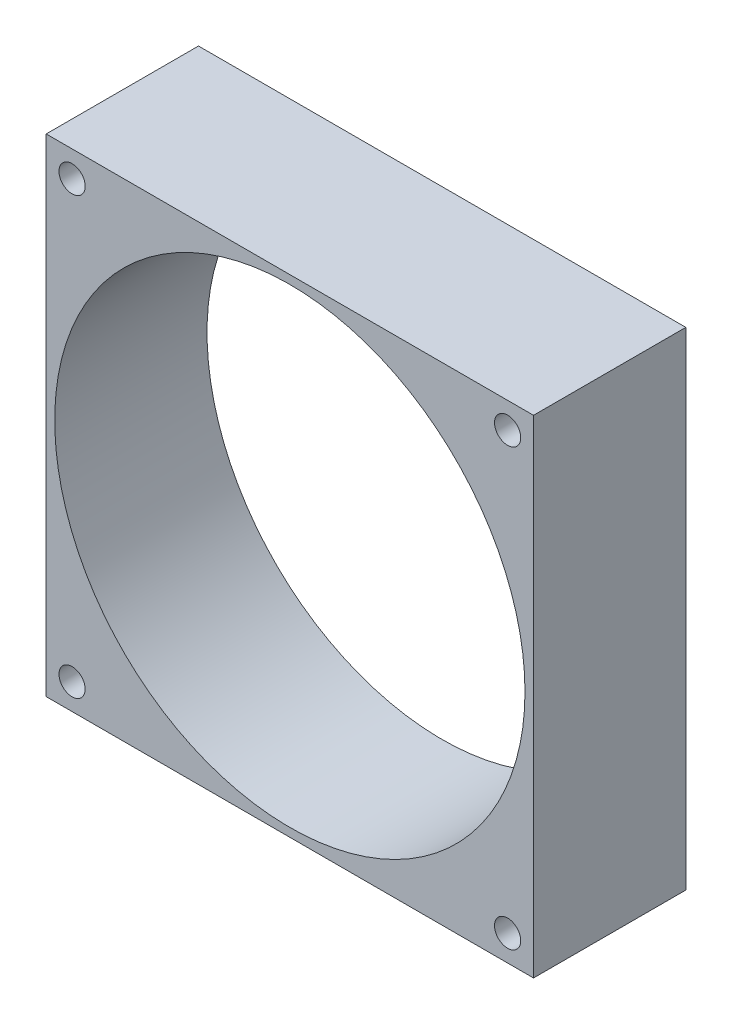
from build123d import *

# Parameters (mm, degrees)
SKETCH1_W           = 80
SKETCH1_H           = 80
SKETCH1_R           = 38.6
SKETCH1_R_2         = 2.15
BOSS_EXTRUDE1_DEPTH = 25


with BuildPart() as part:
    # Sketch1 → Boss-Extrude1 (new body)
    with BuildSketch(Plane.XY):
        with Locations((40, 40)):
            Rectangle(SKETCH1_W, SKETCH1_H)
        with Locations((40, 40)):
            Circle(SKETCH1_R, mode=Mode.SUBTRACT)
        with Locations((4.25, 75.75)):
            Circle(SKETCH1_R_2, mode=Mode.SUBTRACT)
        with Locations(Location((75.75, 75.75, 0), (0, 0, 180))):
            Circle(SKETCH1_R_2, mode=Mode.SUBTRACT)
        with Locations(Location((4.25, 4.25, 0), (0, 0, 180))):
            Circle(SKETCH1_R_2, mode=Mode.SUBTRACT)
        with Locations((75.75, 4.25)):
            Circle(SKETCH1_R_2, mode=Mode.SUBTRACT)
    extrude(amount=BOSS_EXTRUDE1_DEPTH)


solid = part.part
